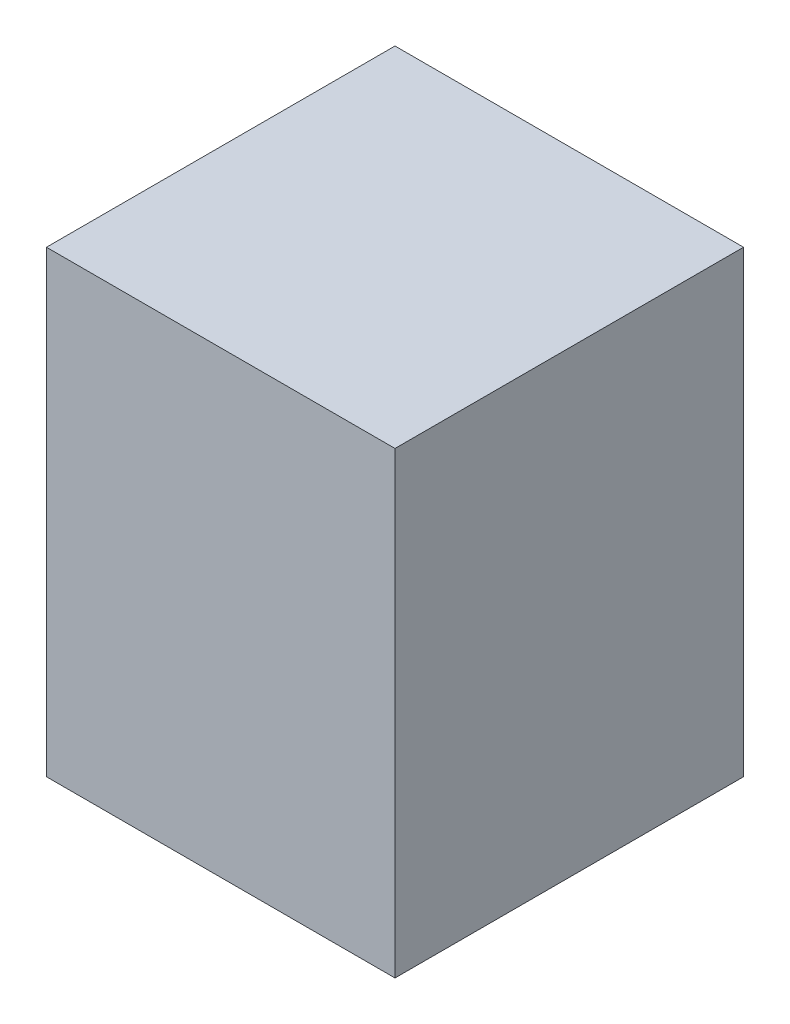
from build123d import *

# Parameters (mm, degrees)
SKETCH1_W           = 48.26
SKETCH1_H           = 63.5
BOSS_EXTRUDE1_DEPTH = 24.13


with BuildPart() as part:
    # Sketch1 → Boss-Extrude1 (new, symmetric)
    with BuildSketch(Plane.XY):
        Rectangle(SKETCH1_W, SKETCH1_H)
    extrude(amount=BOSS_EXTRUDE1_DEPTH, both=True)


solid = part.part
